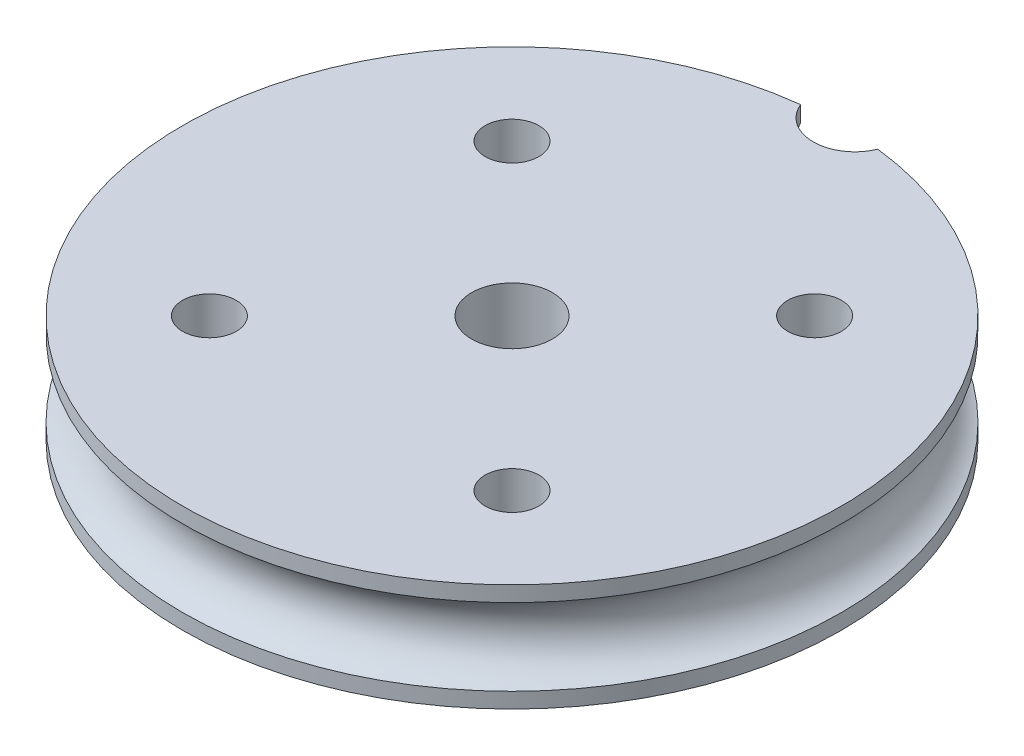
from build123d import *

# Parameters (mm, degrees)
CUT_EXTRUDE_1_DEPTH = 2.5
CUT_EXTRUDE_2_DEPTH = 3
SKETCH_6_R          = 2
CUT_EXTRUDE_4_DEPTH = 36.007142128
SKETCH_8_R          = 3.1
CUT_EXTRUDE_6_DEPTH = 5


with BuildPart() as part:
    # 草图2 → 旋转1 (revolve)
    with BuildSketch(Plane.XY, mode=Mode.PRIVATE) as revolve_1_sk:
        with BuildLine():
            Line((20, 8), (3, 8))
            Line((3, 8), (3, 0))
            Line((3, 0), (20, 0))
            Line((20, 0), (24.5, 0))
            Line((24.5, 0), (24.5, 1.06571985))
            Line((24.5, 1.06571985), (24.5, 1.145070053))
            ThreePointArc((24.5, 1.145070053), (22.475, 4), (24.5, 6.854929947))
            Line((24.5, 6.854929947), (24.5, 6.93428015))
            Line((24.5, 6.93428015), (24.5, 8))
            Line((24.5, 8), (20, 8))
        make_face()
    revolve(revolve_1_sk.sketch.rotate(Axis((0, 0, 0), (0, 1, 0)), 90), axis=Axis((0, 0, 0), (0, 1, 0)))

    # 草图3 → 切除-拉伸1 (cut)
    with BuildSketch(Plane.XZ):
        with BuildLine():
            Line((1.835992055, -17.350058041), (3.408354199, -10.798521635))
            ThreePointArc((3.408354199, -10.798521635), (6.061153739, -6.061181984), (10.798487471, -3.408371874))
            Line((10.798487471, -3.408371874), (17.350061912, -1.835985141))
            ThreePointArc((17.350061912, -1.835985141), (18.129967792, -1.363900547), (18.492480347, -0.527418811))
            Line((18.492480347, -0.527418811), (18.492480347, 0.527418811))
            ThreePointArc((18.492480347, 0.527418811), (18.129968102, 1.363905618), (17.350058041, 1.835992055))
            Line((17.350058041, 1.835992055), (10.798521635, 3.408354199))
            ThreePointArc((10.798521635, 3.408354199), (6.061181984, 6.061153739), (3.408371874, 10.798487471))
            Line((3.408371874, 10.798487471), (1.835985141, 17.350061912))
            ThreePointArc((1.835985141, 17.350061912), (1.363900547, 18.129967792), (0.527418811, 18.492480347))
            Line((0.527418811, 18.492480347), (-0.527418811, 18.492480347))
            ThreePointArc((-0.527418811, 18.492480347), (-1.363905618, 18.129968102), (-1.835992055, 17.350058041))
            Line((-1.835992055, 17.350058041), (-3.408354199, 10.798521635))
            ThreePointArc((-3.408354199, 10.798521635), (-6.061153739, 6.061181984), (-10.798487471, 3.408371874))
            Line((-10.798487471, 3.408371874), (-17.350061912, 1.835985141))
            ThreePointArc((-17.350061912, 1.835985141), (-18.129967792, 1.363900547), (-18.492480347, 0.527418811))
            Line((-18.492480347, 0.527418811), (-18.492480347, -0.527418811))
            ThreePointArc((-18.492480347, -0.527418811), (-18.129968102, -1.363905618), (-17.350058041, -1.835992055))
            Line((-17.350058041, -1.835992055), (-10.798521635, -3.408354199))
            ThreePointArc((-10.798521635, -3.408354199), (-6.061181984, -6.061153739), (-3.408371874, -10.798487471))
            Line((-3.408371874, -10.798487471), (-1.835985141, -17.350061912))
            ThreePointArc((-1.835985141, -17.350061912), (-1.363900547, -18.129967792), (-0.527418811, -18.492480347))
            Line((-0.527418811, -18.492480347), (0.527418811, -18.492480347))
            ThreePointArc((0.527418811, -18.492480347), (1.363905618, -18.129968102), (1.835992055, -17.350058041))
        make_face()
    extrude(amount=-CUT_EXTRUDE_1_DEPTH, mode=Mode.SUBTRACT)

    # 草图4 → 切除-拉伸2 (cut)
    with BuildSketch(Plane.XZ):
        Polygon((7.093078062, 11.25), (9.171539031, 7.65), (13.328460969, 7.65), (15.406921938, 11.25), (13.328460969, 14.85), (9.171539031, 14.85), align=None)
        Polygon((-11.25, 7.093078062), (-7.65, 9.171539031), (-7.65, 13.328460969), (-11.25, 15.406921938), (-14.85, 13.328460969), (-14.85, 9.171539031), align=None)
        Polygon((11.25, -7.093078062), (7.65, -9.171539031), (7.65, -13.328460969), (11.25, -15.406921938), (14.85, -13.328460969), (14.85, -9.171539031), align=None)
        Polygon((-7.093078062, -11.25), (-9.171539031, -7.65), (-13.328460969, -7.65), (-15.406921938, -11.25), (-13.328460969, -14.85), (-9.171539031, -14.85), align=None)
    extrude(amount=-CUT_EXTRUDE_2_DEPTH, mode=Mode.SUBTRACT)

    # 草图6 → 切除-拉伸4 (cut, through all)
    with BuildSketch(Plane.XZ.offset(-3)):
        with Locations(Location((-11.25, 11.25, 0), (0, 0, 270))):
            Circle(SKETCH_6_R)
        with Locations(Location((11.25, 11.25, 0), (0, 0, 270))):
            Circle(SKETCH_6_R)
        with Locations(Location((11.25, -11.25, 0), (0, 0, 270))):
            Circle(SKETCH_6_R)
        with Locations(Location((-11.25, -11.25, 0), (0, 0, 270))):
            Circle(SKETCH_6_R)
    extrude(amount=-CUT_EXTRUDE_4_DEPTH, mode=Mode.SUBTRACT)

    # 草图8 → 切除-拉伸6 (cut)
    with BuildSketch(Plane(origin=(0, 8, 0), x_dir=(1, 0, 0), z_dir=(0, 1, 0))):
        with Locations((0, 25.5)):
            Circle(SKETCH_8_R)
    extrude(amount=-CUT_EXTRUDE_6_DEPTH, mode=Mode.SUBTRACT)


solid = part.part
